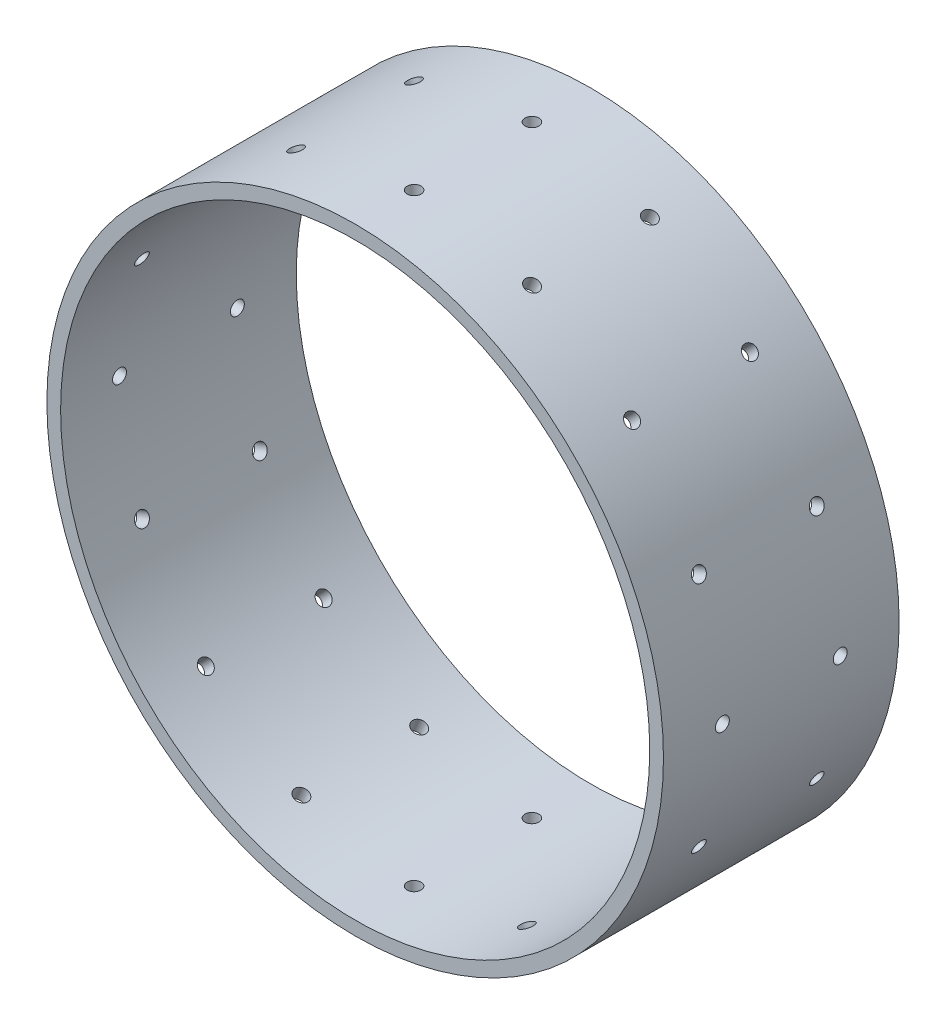
from build123d import *

# Parameters (mm, degrees)
SKETCH1_R                      = 66.4591
SKETCH1_R_2                    = 63.5
EXTRUDE1_DEPTH                 = 50.8
M3X0_5_TAPPED_HOLE1_AT_2_COUNT = 2
M3X0_5_TAPPED_HOLE1_AT_2_PITCH = 25.4
CIRPATTERN1_COUNT              = 16


with BuildPart() as part:
    # Sketch1 → Extrude1 (new body)
    with BuildSketch(Plane.XY):
        Circle(SKETCH1_R)
        Circle(SKETCH1_R_2, mode=Mode.SUBTRACT)
    extrude(amount=EXTRUDE1_DEPTH)

    # Sketch8 → M3x0.5 Tapped Hole1 (revolve, cut)
    with BuildSketch(Plane(origin=(0, 66.4591, 12.7), x_dir=(0, 0, 1), z_dir=(1, 0, 0))):
        Polygon((0, 0), (0, 8.371075774), (1.25, 7.62), (1.25, 6.096), (1.5, 6.096), (1.5, 0), align=None)
    m3x0_5_tapped_hole1 = revolve(axis=Axis((0, 72.8091, 12.7), (0, -1, 0)), mode=Mode.SUBTRACT)

    # M3x0.5 Tapped Hole1 at 2: M3x0.5 Tapped Hole1 ×2
    with Locations(*[(0, 0, i * M3X0_5_TAPPED_HOLE1_AT_2_PITCH) for i in range(1, M3X0_5_TAPPED_HOLE1_AT_2_COUNT)]):
        add(m3x0_5_tapped_hole1, mode=Mode.SUBTRACT)

    # CirPattern1: M3x0.5 Tapped Hole1 ×16 about axis
    cirpattern1_axis = Axis((0, 0, 50.8), (0, 0, -1))
    for i in range(1, CIRPATTERN1_COUNT):
        add(m3x0_5_tapped_hole1.rotate(cirpattern1_axis, i * 360 / CIRPATTERN1_COUNT), mode=Mode.SUBTRACT)

    # CirPattern1 copy 1 sketch → CirPattern1 copy 1 (revolve, cut)
    with BuildSketch(Plane(origin=(25.4327965, 61.400202239, 38.1), x_dir=(0, 0, 1), z_dir=(0.9238795325112867, -0.3826834323650898, 0))):
        Polygon((0, 0), (0, 8.371075774), (1.25, 7.62), (1.25, 6.096), (1.5, 6.096), (1.5, 0), align=None)
    revolve(axis=Axis((27.862836295, 67.266837271, 38.1), (-0.3826834323650898, -0.9238795325112867, 0)), mode=Mode.SUBTRACT)

    # CirPattern1 copy 2 sketch → CirPattern1 copy 2 (revolve, cut)
    with BuildSketch(Plane(origin=(46.993680282, 46.993680282, 38.1), x_dir=(0, 0, 1), z_dir=(0.7071067811865476, -0.7071067811865475, 0))):
        Polygon((0, 0), (0, 8.371075774), (1.25, 7.62), (1.25, 6.096), (1.5, 6.096), (1.5, 0), align=None)
    revolve(axis=Axis((51.483808342, 51.483808342, 38.1), (-0.7071067811865475, -0.7071067811865476, 0)), mode=Mode.SUBTRACT)

    # CirPattern1 copy 3 sketch → CirPattern1 copy 3 (revolve, cut)
    with BuildSketch(Plane(origin=(61.400202239, 25.4327965, 38.1), x_dir=(0, 0, 1), z_dir=(0.38268343236508984, -0.9238795325112867, 0))):
        Polygon((0, 0), (0, 8.371075774), (1.25, 7.62), (1.25, 6.096), (1.5, 6.096), (1.5, 0), align=None)
    revolve(axis=Axis((67.266837271, 27.862836295, 38.1), (-0.9238795325112867, -0.38268343236508984, 0)), mode=Mode.SUBTRACT)

    # CirPattern1 copy 4 sketch → CirPattern1 copy 4 (revolve, cut)
    with BuildSketch(Plane(origin=(66.4591, 0, 38.1), x_dir=(0, 0, 1), z_dir=(0, -1, 0))):
        Polygon((0, 0), (0, 8.371075774), (1.25, 7.62), (1.25, 6.096), (1.5, 6.096), (1.5, 0), align=None)
    revolve(axis=Axis((72.8091, 0, 38.1), (-1, 0, 0)), mode=Mode.SUBTRACT)

    # CirPattern1 copy 5 sketch → CirPattern1 copy 5 (revolve, cut)
    with BuildSketch(Plane(origin=(61.400202239, -25.4327965, 38.1), x_dir=(0, 0, 1), z_dir=(-0.3826834323650897, -0.9238795325112867, 0))):
        Polygon((0, 0), (0, 8.371075774), (1.25, 7.62), (1.25, 6.096), (1.5, 6.096), (1.5, 0), align=None)
    revolve(axis=Axis((67.266837271, -27.862836295, 38.1), (-0.9238795325112867, 0.3826834323650897, 0)), mode=Mode.SUBTRACT)

    # CirPattern1 copy 6 sketch → CirPattern1 copy 6 (revolve, cut)
    with BuildSketch(Plane(origin=(46.993680282, -46.993680282, 38.1), x_dir=(0, 0, 1), z_dir=(-0.7071067811865475, -0.7071067811865476, 0))):
        Polygon((0, 0), (0, 8.371075774), (1.25, 7.62), (1.25, 6.096), (1.5, 6.096), (1.5, 0), align=None)
    revolve(axis=Axis((51.483808342, -51.483808342, 38.1), (-0.7071067811865476, 0.7071067811865475, 0)), mode=Mode.SUBTRACT)

    # CirPattern1 copy 7 sketch → CirPattern1 copy 7 (revolve, cut)
    with BuildSketch(Plane(origin=(25.4327965, -61.400202239, 38.1), x_dir=(0, 0, 1), z_dir=(-0.9238795325112867, -0.3826834323650899, 0))):
        Polygon((0, 0), (0, 8.371075774), (1.25, 7.62), (1.25, 6.096), (1.5, 6.096), (1.5, 0), align=None)
    revolve(axis=Axis((27.862836295, -67.266837271, 38.1), (-0.3826834323650899, 0.9238795325112867, 0)), mode=Mode.SUBTRACT)

    # CirPattern1 copy 8 sketch → CirPattern1 copy 8 (revolve, cut)
    with BuildSketch(Plane(origin=(0, -66.4591, 38.1), x_dir=(0, 0, 1), z_dir=(-1, 0, 0))):
        Polygon((0, 0), (0, 8.371075774), (1.25, 7.62), (1.25, 6.096), (1.5, 6.096), (1.5, 0), align=None)
    revolve(axis=Axis((0, -72.8091, 38.1), (0, 1, 0)), mode=Mode.SUBTRACT)

    # CirPattern1 copy 9 sketch → CirPattern1 copy 9 (revolve, cut)
    with BuildSketch(Plane(origin=(-25.4327965, -61.400202239, 38.1), x_dir=(0, 0, 1), z_dir=(-0.9238795325112868, 0.38268343236508967, 0))):
        Polygon((0, 0), (0, 8.371075774), (1.25, 7.62), (1.25, 6.096), (1.5, 6.096), (1.5, 0), align=None)
    revolve(axis=Axis((-27.862836295, -67.266837271, 38.1), (0.38268343236508967, 0.9238795325112868, 0)), mode=Mode.SUBTRACT)

    # CirPattern1 copy 10 sketch → CirPattern1 copy 10 (revolve, cut)
    with BuildSketch(Plane(origin=(-46.993680282, -46.993680282, 38.1), x_dir=(0, 0, 1), z_dir=(-0.7071067811865477, 0.7071067811865475, 0))):
        Polygon((0, 0), (0, 8.371075774), (1.25, 7.62), (1.25, 6.096), (1.5, 6.096), (1.5, 0), align=None)
    revolve(axis=Axis((-51.483808342, -51.483808342, 38.1), (0.7071067811865475, 0.7071067811865477, 0)), mode=Mode.SUBTRACT)

    # CirPattern1 copy 11 sketch → CirPattern1 copy 11 (revolve, cut)
    with BuildSketch(Plane(origin=(-61.400202239, -25.4327965, 38.1), x_dir=(0, 0, 1), z_dir=(-0.3826834323650895, 0.9238795325112868, 0))):
        Polygon((0, 0), (0, 8.371075774), (1.25, 7.62), (1.25, 6.096), (1.5, 6.096), (1.5, 0), align=None)
    revolve(axis=Axis((-67.266837271, -27.862836295, 38.1), (0.9238795325112868, 0.3826834323650895, 0)), mode=Mode.SUBTRACT)

    # CirPattern1 copy 12 sketch → CirPattern1 copy 12 (revolve, cut)
    with BuildSketch(Plane(origin=(-66.4591, 0, 38.1), x_dir=(0, 0, 1), z_dir=(0, 1, 0))):
        Polygon((0, 0), (0, 8.371075774), (1.25, 7.62), (1.25, 6.096), (1.5, 6.096), (1.5, 0), align=None)
    revolve(axis=Axis((-72.8091, 0, 38.1), (1, 0, 0)), mode=Mode.SUBTRACT)

    # CirPattern1 copy 13 sketch → CirPattern1 copy 13 (revolve, cut)
    with BuildSketch(Plane(origin=(-61.400202239, 25.4327965, 38.1), x_dir=(0, 0, 1), z_dir=(0.38268343236509, 0.9238795325112866, 0))):
        Polygon((0, 0), (0, 8.371075774), (1.25, 7.62), (1.25, 6.096), (1.5, 6.096), (1.5, 0), align=None)
    revolve(axis=Axis((-67.266837271, 27.862836295, 38.1), (0.9238795325112866, -0.38268343236509, 0)), mode=Mode.SUBTRACT)

    # CirPattern1 copy 14 sketch → CirPattern1 copy 14 (revolve, cut)
    with BuildSketch(Plane(origin=(-46.993680282, 46.993680282, 38.1), x_dir=(0, 0, 1), z_dir=(0.7071067811865474, 0.7071067811865477, 0))):
        Polygon((0, 0), (0, 8.371075774), (1.25, 7.62), (1.25, 6.096), (1.5, 6.096), (1.5, 0), align=None)
    revolve(axis=Axis((-51.483808342, 51.483808342, 38.1), (0.7071067811865477, -0.7071067811865474, 0)), mode=Mode.SUBTRACT)

    # CirPattern1 copy 15 sketch → CirPattern1 copy 15 (revolve, cut)
    with BuildSketch(Plane(origin=(-25.4327965, 61.400202239, 38.1), x_dir=(0, 0, 1), z_dir=(0.9238795325112868, 0.38268343236508956, 0))):
        Polygon((0, 0), (0, 8.371075774), (1.25, 7.62), (1.25, 6.096), (1.5, 6.096), (1.5, 0), align=None)
    revolve(axis=Axis((-27.862836295, 67.266837271, 38.1), (0.38268343236508956, -0.9238795325112868, 0)), mode=Mode.SUBTRACT)


solid = part.part
